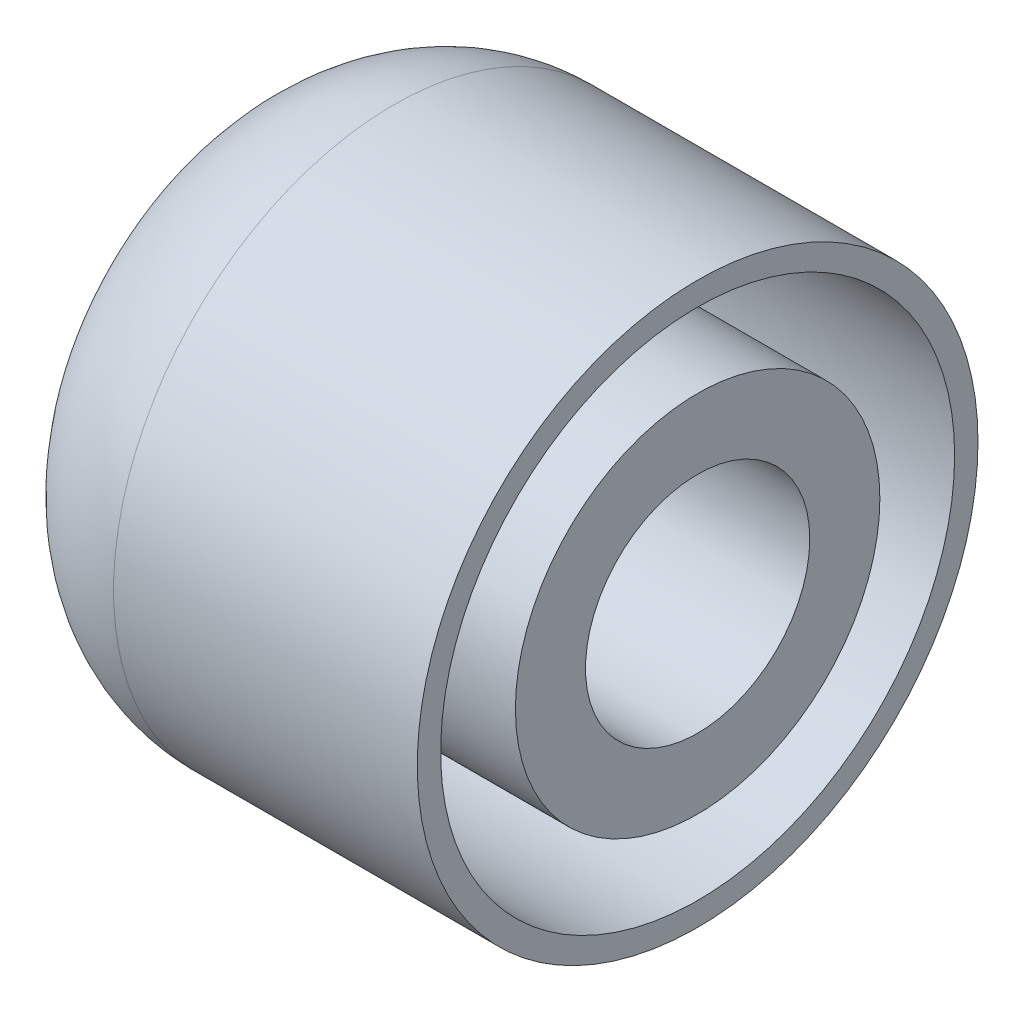
from build123d import *


with BuildPart() as part:
    # Sketch1 → Ear insert (revolve)
    with BuildSketch(Plane.XY, mode=Mode.PRIVATE) as ear_insert_sk:
        with BuildLine():
            Line((0, 6), (-6.5, 6))
            ThreePointArc((-6.5, 6), (-8.974873734, 4.974873734), (-10, 2.5))
            Line((-10, 2.5), (-10, 2.4))
            Line((-10, 2.4), (0, 2.4))
            Line((0, 2.4), (0, 3.9))
            Line((0, 3.9), (-6, 3.9))
            Line((-6, 3.9), (-6, 5.5))
            Line((-6, 5.5), (0, 5.5))
            Line((0, 5.5), (0, 6))
        make_face()
    revolve(ear_insert_sk.sketch.rotate(Axis((0, 0, 0), (-1, 0, 0)), 90), axis=Axis((0, 0, 0), (-1, 0, 0)))


solid = part.part
